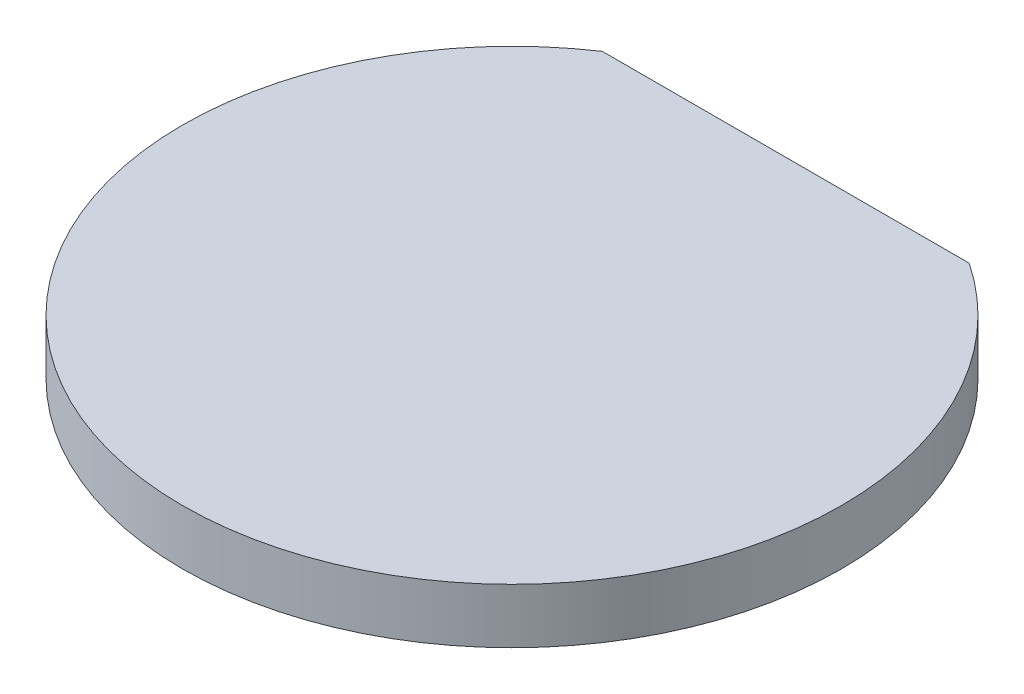
from build123d import *

# Parameters (mm, degrees)
SKETCH1_R               = 38.1
BOSS_EXTRUDE1_DEPTH     = 6.35
CUT_EXTRUDE1_DEPTH      = 55.254423783
CUT_EXTRUDE1_DEPTH_BACK = 55.254423783


with BuildPart() as part:
    # Sketch1 → Boss-Extrude1 (new body)
    with BuildSketch(Plane(origin=(0, 0, 0), x_dir=(1, 0, 0), z_dir=(0, 1, 0))):
        with Locations(Location((0, 0, 0), (0, 0, 270))):
            Circle(SKETCH1_R)
    extrude(amount=BOSS_EXTRUDE1_DEPTH)

    # Sketch2 → Cut-Extrude1 (cut, two sides: drawn at the far end of the back side and taken through both)
    with BuildSketch(Plane(origin=(0, 6.35, 0), x_dir=(1, 0, 0), z_dir=(0, 1, 0)).offset(-CUT_EXTRUDE1_DEPTH_BACK)):
        with BuildLine():
            Line((-21.209, 31.651039778), (21.209, 31.651039778))
            ThreePointArc((21.209, 31.651039778), (0, 38.1), (-21.209, 31.651039778))
        make_face()
    extrude(amount=CUT_EXTRUDE1_DEPTH + CUT_EXTRUDE1_DEPTH_BACK, mode=Mode.SUBTRACT)


solid = part.part
